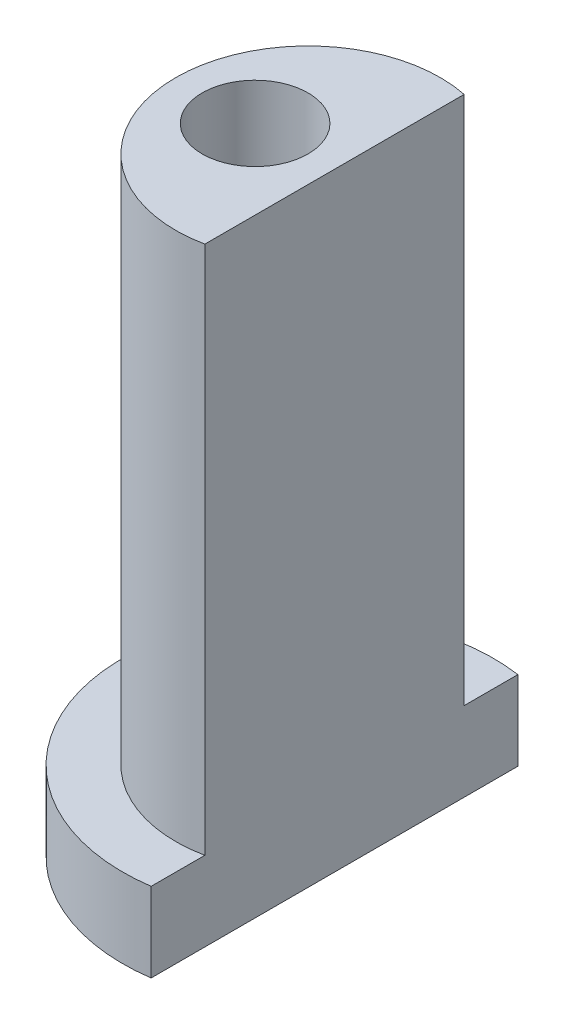
from build123d import *

# Parameters (mm, degrees)
SKETCH_1_R          = 7
EXTRUDE_1_DEPTH     = 3
SKETCH_2_R          = 5
EXTRUDE_2_DEPTH     = 20
SKETCH_3_R          = 2
CUT_EXTRUDE_1_DEPTH = 26.039968051
SKETCH_4_W          = 8.616079813
SKETCH_4_H          = 14.040723598
CUT_EXTRUDE_2_DEPTH = 26.039968051


with BuildPart() as part:
    # 草图1 → 凸台-拉伸1 (new body)
    with BuildSketch(Plane(origin=(0, 0, 0), x_dir=(1, 0, 0), z_dir=(0, 1, 0))):
        with Locations(Location((0, 0, 0), (0, 0, 270))):
            Circle(SKETCH_1_R)
    extrude(amount=EXTRUDE_1_DEPTH)

    # 草图2 → 凸台-拉伸2 (add)
    with BuildSketch(Plane(origin=(0, 3, 0), x_dir=(1, 0, 0), z_dir=(0, 1, 0))):
        with Locations(Location((0, 0, 0), (0, 0, 270))):
            Circle(SKETCH_2_R)
    extrude(amount=EXTRUDE_2_DEPTH)

    # 草图3 → 切除-拉伸1 (cut, through all)
    with BuildSketch(Plane(origin=(0, 23, 0), x_dir=(1, 0, 0), z_dir=(0, 1, 0))):
        with Locations(Location((-2, 0, 0), (0, 0, 270))):
            Circle(SKETCH_3_R)
    extrude(amount=-CUT_EXTRUDE_1_DEPTH, mode=Mode.SUBTRACT)

    # 草图4 → 切除-拉伸2 (cut, through all)
    with BuildSketch(Plane(origin=(0, 23, 0), x_dir=(1, 0, 0), z_dir=(0, 1, 0))):
        with Locations((5.308039907, -0.092158569)):
            Rectangle(SKETCH_4_W, SKETCH_4_H)
    extrude(amount=-CUT_EXTRUDE_2_DEPTH, mode=Mode.SUBTRACT)


solid = part.part
